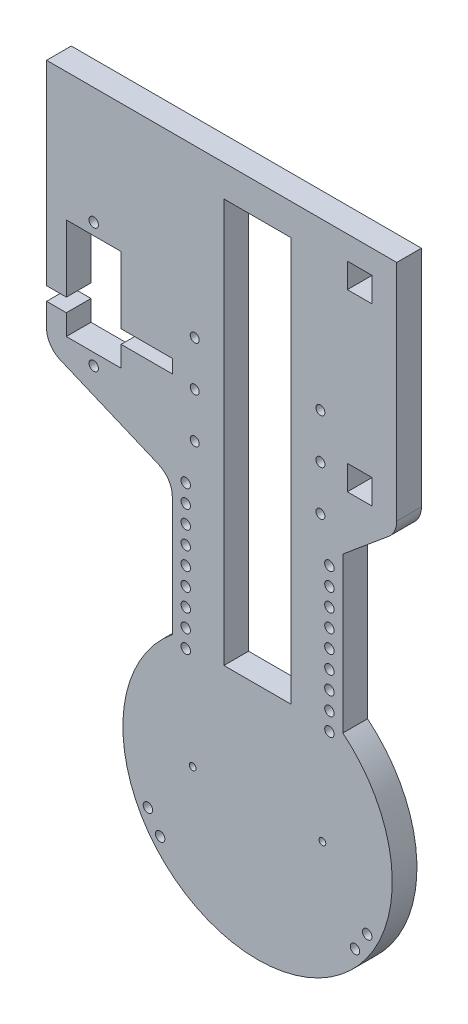
from build123d import *

# Parameters (mm, degrees)
EXTRUDE_1_DEPTH     = 5.5
SKETCH_4_R          = 1
SKETCH_4_W          = 5.5
SKETCH_4_H          = 5.5
CUT_EXTRUDE_2_DEPTH = 129.993216876
FILLET_1_R          = 5
FILLET_2_R          = 5
SKETCH_5_R          = 0.75
CUT_EXTRUDE_3_DEPTH = 129.993216876
SKETCH_6_R          = 1.05
CUT_EXTRUDE_4_DEPTH = 129.993216876
SKETCH_7_W          = 15
SKETCH_7_H          = 90
CUT_EXTRUDE_5_DEPTH = 129.993216876
SKETCH_8_W          = 29.991103618
SKETCH_8_H          = 3
CUT_EXTRUDE_6_DEPTH = 129.993216876
SKETCH_9_R          = 1.05
SKETCH_9_W          = 12.2
SKETCH_9_H          = 22.5
CUT_EXTRUDE_7_DEPTH = 129.993216876
FILLET_3_R          = 5
SKETCH_10_R         = 1.05
CUT_EXTRUDE_8_DEPTH = 129.993216876


with BuildPart() as part:
    # ｽｹｯﾁ1 → ﾎﾞｽ - 押し出し1 (new body)
    with BuildSketch(Plane.XY):
        with BuildLine():
            Line((31, 120), (-47, 120))
            Line((-47, 120), (-47, 65))
            Line((-47, 65), (-19, 53.216373532))
            Line((-19, 53.216373532), (-19, 23.216373532))
            ThreePointArc((-19, 23.216373532), (0, -30), (19, 23.216373532))
            Line((19, 23.216373532), (19, 57.75))
            Line((19, 57.75), (31, 67.75))
            Line((31, 67.75), (31, 120))
        make_face()
    extrude(amount=EXTRUDE_1_DEPTH)

    # ｽｹｯﾁ4 → ｶｯﾄ - 押し出し2 (cut, through all)
    with BuildSketch(Plane.XY.offset(5.5)):
        with Locations((14, 63)):
            Circle(SKETCH_4_R)
        with Locations((14, 83)):
            Circle(SKETCH_4_R)
        with Locations((14, 73)):
            Circle(SKETCH_4_R)
        with Locations(Location((-14, 83, 0), (0, 0, 180))):
            Circle(SKETCH_4_R)
        with Locations(Location((-14, 73, 0), (0, 0, 180))):
            Circle(SKETCH_4_R)
        with Locations(Location((-14, 63, 0), (0, 0, 180))):
            Circle(SKETCH_4_R)
        with Locations((22.75, 112)):
            Rectangle(SKETCH_4_W, SKETCH_4_H)
        with Locations((22.75, 73)):
            Rectangle(SKETCH_4_W, SKETCH_4_H)
    extrude(amount=-CUT_EXTRUDE_2_DEPTH, mode=Mode.SUBTRACT)

    # ﾌｨﾚｯﾄ1
    fillet_1_edges = [part.edges().sort_by_distance(p)[0] for p in [
        (-47, 65, 2.75),
    ]]
    fillet(fillet_1_edges, radius=FILLET_1_R)

    # ﾌｨﾚｯﾄ2
    fillet_2_edges = [part.edges().sort_by_distance(p)[0] for p in [
        (-19, 53.216373532, 2.75),
    ]]
    fillet(fillet_2_edges, radius=FILLET_2_R)

    # ｽｹｯﾁ5 → ｶｯﾄ - 押し出し3 (cut, through all)
    with BuildSketch(Plane.XY.offset(5.5)):
        with Locations((14.45, 0)):
            Circle(SKETCH_5_R)
        with Locations((-14.45, 0)):
            Circle(SKETCH_5_R)
    extrude(amount=-CUT_EXTRUDE_3_DEPTH, mode=Mode.SUBTRACT)

    # ｽｹｯﾁ6 → ｶｯﾄ - 押し出し4 (cut, through all)
    with BuildSketch(Plane.XY.offset(5.5)):
        with Locations((-24.425038206, -12.880897043)):
            Circle(SKETCH_6_R)
        with Locations((-21.701843031, -17.074249883)):
            Circle(SKETCH_6_R)
        with Locations(Location((24.425038206, -12.880897043, 0), (0, 0, 180))):
            Circle(SKETCH_6_R)
        with Locations(Location((21.701843031, -17.074249883, 0), (0, 0, 180))):
            Circle(SKETCH_6_R)
    extrude(amount=-CUT_EXTRUDE_4_DEPTH, mode=Mode.SUBTRACT)

    # ｽｹｯﾁ7 → ｶｯﾄ - 押し出し5 (cut, through all)
    with BuildSketch(Plane.XY.offset(5.5)):
        with Locations((0, 68)):
            Rectangle(SKETCH_7_W, SKETCH_7_H)
    extrude(amount=-CUT_EXTRUDE_5_DEPTH, mode=Mode.SUBTRACT)

    # ｽｹｯﾁ8 → ｶｯﾄ - 押し出し6 (cut, through all)
    with BuildSketch(Plane.XY.offset(5.5)):
        with Locations((-33.995551809, 75)):
            Rectangle(SKETCH_8_W, SKETCH_8_H)
    extrude(amount=-CUT_EXTRUDE_6_DEPTH, mode=Mode.SUBTRACT)

    # ｽｹｯﾁ9 → ｶｯﾄ - 押し出し7 (cut, through all)
    with BuildSketch(Plane.XY.offset(5.5)):
        with Locations((-36.5, 66.3)):
            Circle(SKETCH_9_R)
        with Locations((-36.5, 94)):
            Circle(SKETCH_9_R)
        with Locations((-36.5, 80.15)):
            Rectangle(SKETCH_9_W, SKETCH_9_H)
    extrude(amount=-CUT_EXTRUDE_7_DEPTH, mode=Mode.SUBTRACT)

    # ﾌｨﾚｯﾄ3
    fillet_3_edges = [part.edges().sort_by_distance(p)[0] for p in [
        (31, 67.75, 2.75),
    ]]
    fillet(fillet_3_edges, radius=FILLET_3_R)

    # ｽｹｯﾁ10 → ｶｯﾄ - 押し出し8 (cut, through all)
    with BuildSketch(Plane.XY.offset(5.5)):
        with Locations((16, 22)):
            Circle(SKETCH_10_R)
        with Locations((16, 26)):
            Circle(SKETCH_10_R)
        with Locations((16, 30)):
            Circle(SKETCH_10_R)
        with Locations((16, 34)):
            Circle(SKETCH_10_R)
        with Locations((16, 38)):
            Circle(SKETCH_10_R)
        with Locations((16, 42)):
            Circle(SKETCH_10_R)
        with Locations((16, 46)):
            Circle(SKETCH_10_R)
        with Locations((16, 50)):
            Circle(SKETCH_10_R)
        with Locations(Location((-16, 50, 0), (0, 0, 180))):
            Circle(SKETCH_10_R)
        with Locations(Location((-16, 46, 0), (0, 0, 180))):
            Circle(SKETCH_10_R)
        with Locations(Location((-16, 42, 0), (0, 0, 180))):
            Circle(SKETCH_10_R)
        with Locations(Location((-16, 38, 0), (0, 0, 180))):
            Circle(SKETCH_10_R)
        with Locations(Location((-16, 34, 0), (0, 0, 180))):
            Circle(SKETCH_10_R)
        with Locations(Location((-16, 30, 0), (0, 0, 180))):
            Circle(SKETCH_10_R)
        with Locations(Location((-16, 26, 0), (0, 0, 180))):
            Circle(SKETCH_10_R)
        with Locations(Location((-16, 22, 0), (0, 0, 180))):
            Circle(SKETCH_10_R)
        with Locations((16, 54)):
            Circle(SKETCH_10_R)
        with Locations(Location((-16, 54, 0), (0, 0, 180))):
            Circle(SKETCH_10_R)
    extrude(amount=-CUT_EXTRUDE_8_DEPTH, mode=Mode.SUBTRACT)


solid = part.part
